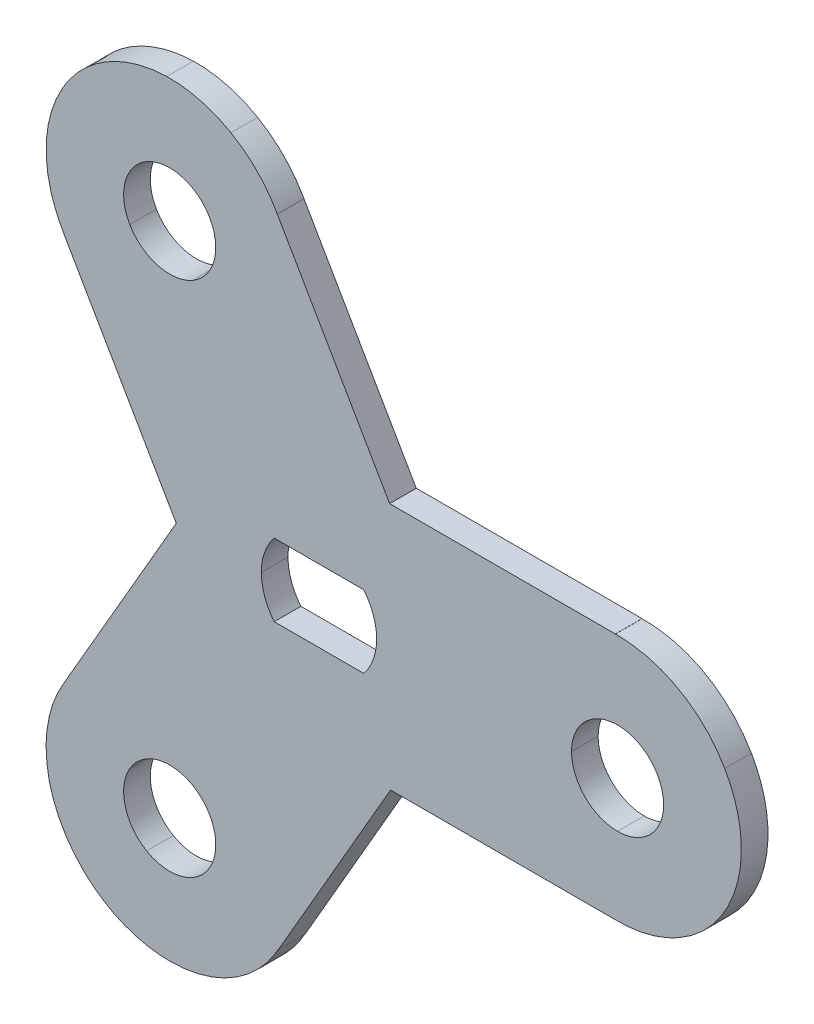
from build123d import *

# Parameters (mm, degrees)
BOSS_EXTRUDE5_DEPTH = 1.5875


with BuildPart() as part:
    # carrier → Boss-Extrude5 (new body)
    with BuildSketch(Plane(origin=(-89.612357323, 67.458483608, 0), x_dir=(1, 0, 0), z_dir=(0, 0, 1))):
        with BuildLine():
            Line((118.819010038, 161.989326691), (118.810191038, 161.980520691))
            Line((118.810191038, 161.980520691), (125.512969038, 150.382951691))
            Line((125.512969038, 150.382951691), (118.819010038, 138.794201691))
            Line((118.819010038, 138.794201691), (118.810191038, 138.776562691))
            add(Edge.make_bspline(
                [(118.810191038, 138.776562691), (118.138894038, 137.665721691), (117.760677038, 136.367990691), (117.760677038, 134.975382691)],
                knots=[0, 0, 0, 0, 1, 1, 1, 1], degree=3))
            add(Edge.make_bspline(
                [(117.760677038, 134.975382691), (117.760675038, 130.905661691), (121.064010038, 127.602323691), (125.133733038, 127.602326691)],
                knots=[0, 0, 0, 0, 1, 1, 1, 1], degree=3))
            add(Edge.make_bspline(
                [(125.133733038, 127.602326691), (127.909953038, 127.602326691), (130.315556038, 129.144498691), (131.571927038, 131.412326691)],
                knots=[0, 0, 0, 0, 1, 1, 1, 1], degree=3))
            Line((131.571927038, 131.412326691), (131.580732038, 131.403521691))
            Line((131.580732038, 131.403521691), (138.283510038, 143.009910691))
            Line((138.283510038, 143.009910691), (151.653788038, 143.009910691))
            Line((151.653788038, 143.009910691), (151.671427038, 143.009910691))
            add(Edge.make_bspline(
                [(151.671427038, 143.009910691), (152.969090038, 142.983973691), (154.284212038, 143.301383691), (155.490246038, 143.997687691)],
                knots=[0, 0, 0, 0, 1, 1, 1, 1], degree=3))
            add(Edge.make_bspline(
                [(155.490246038, 143.997687691), (159.014728038, 146.032549691), (160.223858038, 150.545012691), (158.188996038, 154.069493691)],
                knots=[0, 0, 0, 0, 1, 1, 1, 1], degree=3))
            add(Edge.make_bspline(
                [(158.188996038, 154.069493691), (156.800886038, 156.473769691), (154.263610038, 157.793065691), (151.671427038, 157.747201691)],
                knots=[0, 0, 0, 0, 1, 1, 1, 1], degree=3))
            Line((151.671427038, 157.747201691), (151.671427038, 157.754849091))
            Line((151.671427038, 157.754849091), (138.224971754, 157.754849091))
            Line((138.224971754, 157.754849091), (131.539832754, 169.334779091))
            Line((131.539832754, 169.334779091), (131.531027754, 169.352418091))
            add(Edge.make_bspline(
                [(131.531027754, 169.352418091), (130.904660754, 170.489198091), (129.976575754, 171.469517091), (128.770540754, 172.165821091)],
                knots=[0, 0, 0, 0, 1, 1, 1, 1], degree=3))
            add(Edge.make_bspline(
                [(128.770540754, 172.165821091), (127.565708199, 172.861433534), (126.244241887, 173.179504317), (124.946928377, 173.154056045)],
                knots=[0, 0, 0, 0, 0.994463703, 0.994463703, 0.994463703, 0.994463703], degree=3))
            add(Edge.make_bspline(
                [(124.946928377, 173.154056045), (122.467005204, 173.088633853), (120.078815068, 171.772470761), (118.748455038, 169.468215691)],
                knots=[0.003756223, 0.003756223, 0.003756223, 0.003756223, 1, 1, 1, 1], degree=3))
            add(Edge.make_bspline(
                [(118.748455038, 169.468215691), (117.360345038, 167.063938691), (117.483199038, 164.211290691), (118.819010038, 161.989326691)],
                knots=[0, 0, 0, 0, 1, 1, 1, 1], degree=3))
        make_face()
        with BuildLine():
            Line((131.348201, 148.224924), (136.683962, 148.224924))
            add(Edge.make_bspline(
                [(136.683962, 148.224924), (137.161645, 148.814777), (137.451253, 149.56754), (137.451253, 150.385688)],
                knots=[0, 0, 0, 0, 1, 1, 1, 1], degree=3))
            add(Edge.make_bspline(
                [(137.451253, 150.385688), (137.451253, 151.203836), (137.161645, 151.94778), (136.683962, 152.537633)],
                knots=[0, 0, 0, 0, 1, 1, 1, 1], degree=3))
            Line((136.683962, 152.537633), (131.348201, 152.537633))
            add(Edge.make_bspline(
                [(131.348201, 152.537633), (130.870517, 151.94778), (130.580909, 151.203836), (130.580909, 150.385688)],
                knots=[0, 0, 0, 0, 1, 1, 1, 1], degree=3))
            add(Edge.make_bspline(
                [(130.580909, 150.385688), (130.580909, 149.56754), (130.870517, 148.814777), (131.348201, 148.224924)],
                knots=[0, 0, 0, 0, 1, 1, 1, 1], degree=3))
        make_face(mode=Mode.SUBTRACT)
        with BuildLine():
            add(Edge.make_bspline(
                [(154.547076, 150.381274), (154.547076, 148.865969), (153.318678, 147.637574), (151.803377, 147.637574)],
                knots=[0, 0, 0, 0, 1, 1, 1, 1], degree=3))
            add(Edge.make_bspline(
                [(151.803377, 147.637574), (150.288072, 147.637574), (149.059677, 148.865969), (149.059677, 150.381274)],
                knots=[0, 0, 0, 0, 1, 1, 1, 1], degree=3))
            add(Edge.make_bspline(
                [(149.059677, 150.381274), (149.059677, 151.896576), (150.288072, 153.124973), (151.803377, 153.124973)],
                knots=[0, 0, 0, 0, 1, 1, 1, 1], degree=3))
            add(Edge.make_bspline(
                [(151.803377, 153.124973), (153.318678, 153.124973), (154.547076, 151.896576), (154.547076, 150.381274)],
                knots=[0, 0, 0, 0, 1, 1, 1, 1], degree=3))
        make_face(mode=Mode.SUBTRACT)
        with BuildLine():
            add(Edge.make_bspline(
                [(123.750123, 168.162095), (125.062416, 168.919747), (126.740436, 168.470121), (127.498087, 167.157831)],
                knots=[0, 0, 0, 0, 1, 1, 1, 1], degree=3))
            add(Edge.make_bspline(
                [(127.498087, 167.157831), (128.255739, 165.845539), (127.806115, 164.16752), (126.493823, 163.409868)],
                knots=[0, 0, 0, 0, 1, 1, 1, 1], degree=3))
            add(Edge.make_bspline(
                [(126.493823, 163.409868), (125.181533, 162.652217), (123.503512, 163.101839), (122.74586, 164.414132)],
                knots=[0, 0, 0, 0, 1, 1, 1, 1], degree=3))
            add(Edge.make_bspline(
                [(122.74586, 164.414132), (121.988209, 165.726422), (122.437834, 167.404444), (123.750123, 168.162095)],
                knots=[0, 0, 0, 0, 1, 1, 1, 1], degree=3))
        make_face(mode=Mode.SUBTRACT)
        with BuildLine():
            add(Edge.make_bspline(
                [(123.750127, 132.600451), (122.437834, 133.358103), (121.988212, 135.036124), (122.745863, 136.348414)],
                knots=[0, 0, 0, 0, 1, 1, 1, 1], degree=3))
            add(Edge.make_bspline(
                [(122.745863, 136.348414), (123.503515, 137.660706), (125.181534, 138.11033), (126.493826, 137.352678)],
                knots=[0, 0, 0, 0, 1, 1, 1, 1], degree=3))
            add(Edge.make_bspline(
                [(126.493826, 137.352678), (127.806116, 136.595027), (128.255742, 134.917007), (127.49809, 133.604715)],
                knots=[0, 0, 0, 0, 1, 1, 1, 1], degree=3))
            add(Edge.make_bspline(
                [(127.49809, 133.604715), (126.740439, 132.292425), (125.062417, 131.8428), (123.750127, 132.600451)],
                knots=[0, 0, 0, 0, 1, 1, 1, 1], degree=3))
        make_face(mode=Mode.SUBTRACT)
    extrude(amount=BOSS_EXTRUDE5_DEPTH)


solid = part.part
